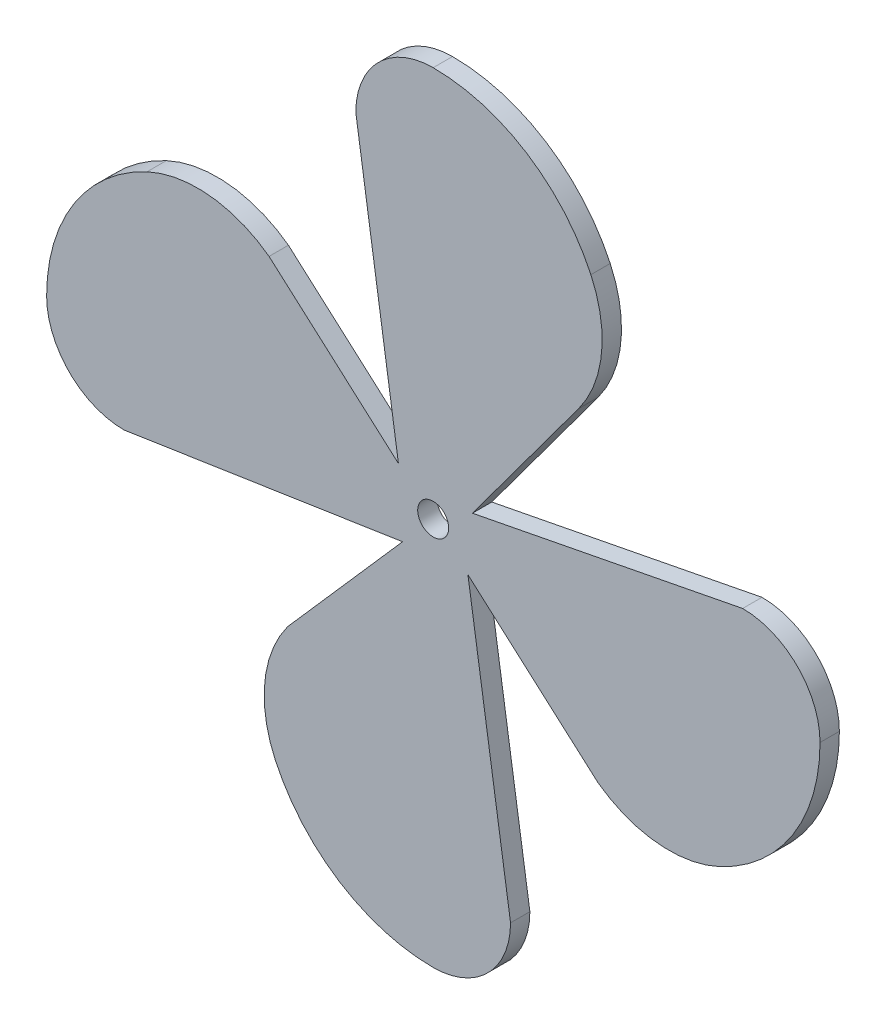
from build123d import *

# Parameters (mm, degrees)
SKETCH2_R           = 12
SKETCH2_R_2         = 4
BOSS_EXTRUDE1_DEPTH = 5


with BuildPart() as part:
    # Sketch2 → Boss-Extrude1 (new body)
    # profile 1 of 5: a face of its own
    with BuildSketch(Plane.XY):
        with BuildLine():
            ThreePointArc((0, 101.058278507), (-14.142135624, 95.200414131), (-20, 81.058278507))
            Line((-20, 81.058278507), (-8.978854785, 7.961166168))
            ThreePointArc((-8.978854785, 7.961166168), (0.973561331, 11.96044223), (10.148177695, 6.404255575))
            Line((10.148177695, 6.404255575), (37.612146598, 43.558278507))
            ThreePointArc((37.612146598, 43.558278507), (43.529493891, 58.89995601), (40.768147941, 75.109738122))
            ThreePointArc((40.768147941, 75.109738122), (24.162825966, 94.020863263), (0, 101.058278507))
        make_face()
    # profile 2 of 5: a face of its own
    with BuildSketch(Plane.XY):
        with BuildLine():
            ThreePointArc((-7.914553223, -9.019969361), (-11.976499885, -0.750633402), (-8.978854785, 7.961166168))
            Line((-8.978854785, 7.961166168), (-42.420167513, 37.612146598))
            ThreePointArc((-42.420167513, 37.612146598), (-57.761845016, 43.529493891), (-73.971627128, 40.768147941))
            ThreePointArc((-73.971627128, 40.768147941), (-92.882752269, 24.162825966), (-99.920167513, 0))
            ThreePointArc((-99.920167513, 0), (-94.062303137, -14.142135624), (-79.920167513, -20))
            Line((-79.920167513, -20), (-7.914553223, -9.019969361))
        make_face()
    # profile 3 of 5: a face of its own
    with BuildSketch(Plane.XY):
        with BuildLine():
            Line((80, 20), (10.148177695, 6.404255575))
            ThreePointArc((10.148177695, 6.404255575), (11.527752, 3.333306741), (12, 0))
            ThreePointArc((12, 0), (11.221304846, -4.252330837), (8.986280409, -7.952783438))
            Line((8.986280409, -7.952783438), (42.5, -37.612146598))
            ThreePointArc((42.5, -37.612146598), (57.841677503, -43.529493891), (74.051459615, -40.768147941))
            ThreePointArc((74.051459615, -40.768147941), (92.962584756, -24.162825966), (100, 0))
            ThreePointArc((100, 0), (94.142135624, 14.142135624), (80, 20))
        make_face()
    # profile 4 of 5: a face of its own
    with BuildSketch(Plane.XY):
        with BuildLine():
            ThreePointArc((8.986280409, -7.952783438), (0.756221686, -11.976148327), (-7.914553223, -9.019969361))
            Line((-7.914553223, -9.019969361), (-37.612146598, -42.865389918))
            ThreePointArc((-37.612146598, -42.865389918), (-43.529493891, -58.207067421), (-40.768147941, -74.416849533))
            ThreePointArc((-40.768147941, -74.416849533), (-24.162825966, -93.327974674), (0, -100.365389918))
            ThreePointArc((0, -100.365389918), (14.142135624, -94.507525542), (20, -80.365389918))
            Line((20, -80.365389918), (8.986280409, -7.952783438))
        make_face()
    # profile 5 of 5: a face of its own
    with BuildSketch(Plane.XY):
        Circle(SKETCH2_R)
        Circle(SKETCH2_R_2, mode=Mode.SUBTRACT)
    extrude(amount=BOSS_EXTRUDE1_DEPTH)


solid = part.part
